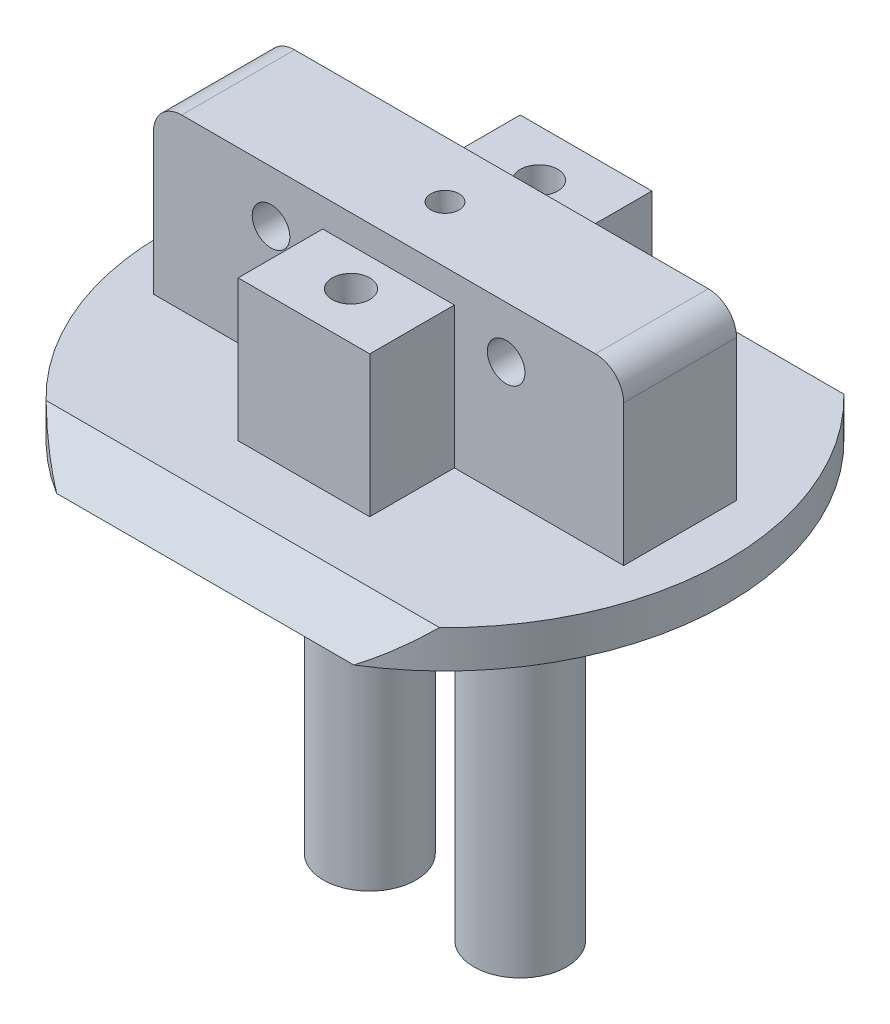
from build123d import *
from build123d.topology import SkipClean

# Parameters (mm, degrees)
SKETCH1_R                            = 30
BOSS_EXTRUDE1_DEPTH                  = 4
BOSS_EXTRUDE2_REACH                  = 44.615
BOSS_EXTRUDE2_END_RADIUS             = 30
BOSS_EXTRUDE2_DIRECTION_2_REACH      = 44.615
BOSS_EXTRUDE2_DIRECTION_2_END_RADIUS = 30
SKETCH3_OUTSIDE_W                    = 78.092
SKETCH3_OUTSIDE_H                    = 69.092
SKETCH3_OUTSIDE_R                    = 21.5
CUT_EXTRUDE2_DEPTH                   = 12.5
BOSS_EXTRUDE3_DEPTH                  = 18
BOSS_EXTRUDE4_DEPTH                  = 15
BOSS_EXTRUDE5_DEPTH                  = 15
CUT_EXTRUDE3_DEPTH                   = 44.292609069
CUT_EXTRUDE3_DEPTH_BACK              = 44.292609069
SKETCH8_R                            = 2
CUT_EXTRUDE8_DEPTH                   = 48.077064479
CUT_EXTRUDE8_DEPTH_BACK              = 48.077064479
CUT_EXTRUDE9_DEPTH                   = 59.659818207
CUT_EXTRUDE11_DEPTH                  = 20
CUT_EXTRUDE12_DEPTH                  = 20
CUT_EXTRUDE13_DEPTH                  = 20
CUT_EXTRUDE14_DEPTH                  = 44.292609069
CUT_EXTRUDE14_DEPTH_BACK             = 44.292609069
SKETCH25_W                           = 66.075437062
SKETCH25_H                           = 20.142243048
SKETCH27_R                           = 1.5
CUT_EXTRUDE16_DEPTH                  = 30
SKETCH28_R                           = 5
CUT_EXTRUDE17_DEPTH                  = 3
CUT_EXTRUDE18_DEPTH                  = 43.690748412
CUT_EXTRUDE18_DEPTH_BACK             = 43.690748412
SKETCH29_W                           = 43.412566799
SKETCH29_H                           = 13.326200919
SKETCH32_W                           = 50
SKETCH32_H                           = 12
BOSS_EXTRUDE6_DEPTH                  = 18
SKETCH35_W                           = 14
SKETCH35_H                           = 15
BOSS_EXTRUDE7_DEPTH                  = 9
CUT_EXTRUDE19_DEPTH                  = 49.746794766
CUT_EXTRUDE19_DEPTH_BACK             = 49.746794766
SKETCH37_R                           = 2
SKETCH36_R                           = 2
CUT_EXTRUDE20_DEPTH                  = 15
SKETCH39_W                           = 14
SKETCH39_H                           = 15
BOSS_EXTRUDE8_DEPTH                  = 9
SKETCH40_R                           = 2
CUT_EXTRUDE21_DEPTH                  = 10
FILLET1_R                            = 3
FILLET2_R                            = 3
CUT_EXTRUDE24_START                  = -20
SKETCH44_R                           = 1.5
CUT_EXTRUDE24_DEPTH                  = 20
SKETCH45_R                           = 4.925
BOSS_EXTRUDE9_DEPTH                  = 42
SKETCH46_R                           = 1.8923
CUT_EXTRUDE25_DEPTH                  = 25.4
SKETCH47_R                           = 1.8923
CUT_EXTRUDE26_DEPTH                  = 25.4


with BuildPart() as part:
    # Sketch1 → Boss-Extrude1 (new body)
    with BuildSketch(Plane(origin=(0, 0, 0), x_dir=(1, 0, 0), z_dir=(0, 1, 0))):
        with Locations(Location((0, 0, 0), (0, 0, 270))):
            Circle(SKETCH1_R)
    extrude(amount=BOSS_EXTRUDE1_DEPTH)

    # Boss-Extrude2: up to this cylinder (the profile starts inside it)
    with SkipClean():  # the faces are left unmerged after this step: merging them gives an invalid solid
        boss_extrude2_end = Plane(origin=(0, 9.396175, 0), z_dir=(0, -1, 0)) * Cylinder(BOSS_EXTRUDE2_END_RADIUS, 150.23, mode=Mode.PRIVATE)
        # Sketch2 → Boss-Extrude2 (add, up to the surface)
        with BuildSketch(Plane(origin=(0, 0, 0), x_dir=(0, 0, -1), z_dir=(1, 0, 0)), mode=Mode.PRIVATE) as boss_extrude2_sk1:
            Polygon((0, 4), (21.5, 4), (9, 16.5), (-9, 16.5), (-21.5, 4), align=None)
        boss_extrude2_tool1 = extrude(boss_extrude2_sk1.sketch, amount=BOSS_EXTRUDE2_REACH, mode=Mode.PRIVATE) & boss_extrude2_end
        add(boss_extrude2_tool1.solids().sort_by_distance((0, 9.396175, 0))[0])

    # Boss-Extrude2 direction 2: up to this cylinder (the profile starts inside it)
    with SkipClean():  # the faces are left unmerged after this step: merging them gives an invalid solid
        boss_extrude2_direction_2_end = Plane(origin=(0, 9.396175, 0), z_dir=(0, -1, 0)) * Cylinder(BOSS_EXTRUDE2_DIRECTION_2_END_RADIUS, 150.23, mode=Mode.PRIVATE)
        # Sketch2 → Boss-Extrude2 direction 2 (add, up to the surface)
        with BuildSketch(Plane(origin=(0, 0, 0), x_dir=(0, 0, -1), z_dir=(1, 0, 0)), mode=Mode.PRIVATE) as boss_extrude2_direction_2_sk1:
            Polygon((0, 4), (21.5, 4), (9, 16.5), (-9, 16.5), (-21.5, 4), align=None)
        boss_extrude2_direction_2_tool1 = extrude(boss_extrude2_direction_2_sk1.sketch, amount=-BOSS_EXTRUDE2_DIRECTION_2_REACH, mode=Mode.PRIVATE) & boss_extrude2_direction_2_end
        add(boss_extrude2_direction_2_tool1.solids().sort_by_distance((0, 9.396175, 0))[0])

    # SurfaceCut1
    split(bisect_by=Plane(origin=(0, 12.75, -12.75), x_dir=(1, 0, 0), z_dir=(0, 0.7071067811865558, -0.7071067811865392)), keep=Keep.BOTTOM)

    # SurfaceCut2
    split(bisect_by=Plane(origin=(0, 12.75, 12.75), x_dir=(1, 0, 0), z_dir=(0, 0.7071067811865509, 0.7071067811865442)), keep=Keep.BOTTOM)

    # Sketch3 outside → Cut-Extrude2 (cut)
    with BuildSketch(Plane(origin=(0, 4, 0), x_dir=(1, 0, 0), z_dir=(0, 1, 0))):
        Rectangle(SKETCH3_OUTSIDE_W, SKETCH3_OUTSIDE_H)
        Circle(SKETCH3_OUTSIDE_R, mode=Mode.SUBTRACT)
    extrude(amount=CUT_EXTRUDE2_DEPTH, mode=Mode.SUBTRACT)

    # Sketch5 → Boss-Extrude3 (add)
    with BuildSketch(Plane(origin=(0, 0, 0), x_dir=(-1, 0, 0), z_dir=(0, -1, 0))):
        Polygon((0, -6), (-17.5, -6), (-17.5, 6), (17.5, 6), (17.5, -6), align=None)
    extrude(amount=BOSS_EXTRUDE3_DEPTH)

    # Sketch6 → Boss-Extrude4 (add)
    with BuildSketch(Plane.XZ):
        Polygon((0, 15), (7, 15), (7, 6), (-7, 6), (-7, 15), align=None)
    extrude(amount=BOSS_EXTRUDE4_DEPTH)

    # Sketch7 → Boss-Extrude5 (add)
    with BuildSketch(Plane.XZ):
        Polygon((0, -15), (7, -15), (7, -6), (-7, -6), (-7, -15), align=None)
    extrude(amount=BOSS_EXTRUDE5_DEPTH)

    # Sketch8 → Cut-Extrude3 (cut, two sides: drawn at the far end of the back side and taken through both)
    with BuildSketch(Plane.XY.offset(-CUT_EXTRUDE3_DEPTH_BACK)):
        with Locations((-12.5, -12.5)):
            Circle(SKETCH8_R)
        with Locations((12.5, -12.5)):
            Circle(SKETCH8_R)
    extrude(amount=CUT_EXTRUDE3_DEPTH + CUT_EXTRUDE3_DEPTH_BACK, mode=Mode.SUBTRACT)

    # Sketch16 → Cut-Extrude8 (cut, two sides: drawn at the far end of the back side and taken through both)
    with BuildSketch(Plane.XY.offset(6).offset(-CUT_EXTRUDE8_DEPTH_BACK)):
        Polygon((17.5, -18), (17.5, -14.5), (14, -18), align=None)
        Polygon((-17.5, -18), (-14, -18), (-17.5, -14.5), align=None)
    extrude(amount=CUT_EXTRUDE8_DEPTH + CUT_EXTRUDE8_DEPTH_BACK, mode=Mode.SUBTRACT)

    # Sketch17 → Cut-Extrude9 (cut, through all)
    with BuildSketch(Plane(origin=(10.365975269, -9.674910251, -8.062425209), x_dir=(-0.3613483622370374, 0.337258471421235, -0.8693009171531012), z_dir=(0.6355070151731325, -0.5931398808282571, -0.49428323402354774))):
        Polygon((-2.372510104, -6.189601271), (7.980636686, -0.706686759), (7.980636686, -10.965829024), align=None)
    extrude(amount=CUT_EXTRUDE9_DEPTH, mode=Mode.SUBTRACT)

    # Sketch19 → Cut-Extrude11 (cut)
    with BuildSketch(Plane(origin=(-10.365975269, -9.674910251, -8.062425209), x_dir=(0.3613483622370374, 0.33725847142123494, -0.8693009171531012), z_dir=(0.6355070151731324, 0.5931398808282571, 0.4942832340235476))):
        Polygon((-2.372510104, -6.189601271), (7.980636686, -10.965829024), (7.980636686, -0.706686759), align=None)
    extrude(amount=-CUT_EXTRUDE11_DEPTH, mode=Mode.SUBTRACT)

    # Sketch20 → Cut-Extrude12 (cut)
    with BuildSketch(Plane(origin=(-10.365975269, -9.674910251, 8.062425209), x_dir=(-0.3613483622370374, -0.3372584714212349, -0.8693009171531013), z_dir=(0.6355070151731326, 0.593139880828257, -0.49428323402354757))):
        Polygon((2.372510104, -6.189601271), (-7.980636686, -0.706686759), (-7.980636686, -10.965829024), align=None)
    extrude(amount=-CUT_EXTRUDE12_DEPTH, mode=Mode.SUBTRACT)

    # Sketch21 → Cut-Extrude13 (cut)
    with BuildSketch(Plane(origin=(10.365975269, -9.674910251, 8.062425209), x_dir=(-0.3613483622370374, 0.3372584714212349, 0.8693009171531013), z_dir=(-0.6355070151731326, 0.593139880828257, -0.49428323402354757))):
        Polygon((-2.372510104, -6.189601271), (7.980636686, -0.706686759), (7.980636686, -10.965829024), align=None)
    extrude(amount=-CUT_EXTRUDE13_DEPTH, mode=Mode.SUBTRACT)

    # Sketch25 → Cut-Extrude14 (cut, two sides: drawn at the far end of the back side and taken through both)
    with BuildSketch(Plane.XY.offset(-CUT_EXTRUDE14_DEPTH_BACK)):
        with Locations((0, -10.071121524)):
            Rectangle(SKETCH25_W, SKETCH25_H)
    extrude(amount=CUT_EXTRUDE14_DEPTH + CUT_EXTRUDE14_DEPTH_BACK, mode=Mode.SUBTRACT)

    # Sketch27 → Cut-Extrude16 (cut)
    with BuildSketch(Plane(origin=(0, 16.5, 0), x_dir=(1, 0, 0), z_dir=(0, 1, 0))):
        with Locations(Location((0, 0, 0), (0, 0, 270))):
            Circle(SKETCH27_R)
    extrude(amount=-CUT_EXTRUDE16_DEPTH, mode=Mode.SUBTRACT)

    # Sketch28 → Cut-Extrude17 (cut)
    with BuildSketch(Plane.XZ):
        with Locations(Location((0, -15, 0), (0, 0, 270))):
            Circle(SKETCH28_R)
        with Locations(Location((22, 0, 0), (0, 0, 270))):
            Circle(SKETCH28_R)
        with Locations(Location((0, 15, 0), (0, 0, 270))):
            Circle(SKETCH28_R)
        with Locations(Location((-22, 0, 0), (0, 0, 270))):
            Circle(SKETCH28_R)
        with Locations(Location((-14, 12, 0), (0, 0, 270))):
            Circle(SKETCH28_R)
        with Locations(Location((14, 12, 0), (0, 0, 270))):
            Circle(SKETCH28_R)
        with Locations(Location((14, -12, 0), (0, 0, 270))):
            Circle(SKETCH28_R)
        with Locations(Location((-14, -12, 0), (0, 0, 270))):
            Circle(SKETCH28_R)
    extrude(amount=-CUT_EXTRUDE17_DEPTH, mode=Mode.SUBTRACT)

    # Sketch29 → Cut-Extrude18 (cut, two sides: drawn at the far end of the back side and taken through both)
    with BuildSketch(Plane(origin=(0, 0, 0), x_dir=(0, 0, -1), z_dir=(1, 0, 0)).offset(-CUT_EXTRUDE18_DEPTH_BACK)):
        with Locations((0.2062834, 10.66310046)):
            Rectangle(SKETCH29_W, SKETCH29_H)
    extrude(amount=CUT_EXTRUDE18_DEPTH + CUT_EXTRUDE18_DEPTH_BACK, mode=Mode.SUBTRACT)

    # Sketch32 → Boss-Extrude6 (add)
    with BuildSketch(Plane(origin=(0, 4, 0), x_dir=(1, 0, 0), z_dir=(0, 1, 0))):
        Rectangle(SKETCH32_W, SKETCH32_H)
    extrude(amount=BOSS_EXTRUDE6_DEPTH)

    # Sketch35 → Boss-Extrude7 (add)
    with BuildSketch(Plane(origin=(0, 0, -6), x_dir=(-1, 0, 0), z_dir=(0, 0, -1))):
        with Locations((0, 11.5)):
            Rectangle(SKETCH35_W, SKETCH35_H)
    extrude(amount=BOSS_EXTRUDE7_DEPTH)

    # Sketch37 → Cut-Extrude19 (cut, two sides: drawn at the far end of the back side and taken through both)
    with BuildSketch(Plane(origin=(0, 0, -6), x_dir=(-1, 0, 0), z_dir=(0, 0, -1)).offset(-CUT_EXTRUDE19_DEPTH_BACK)):
        with Locations((-12.5, 16.5)):
            Circle(SKETCH37_R)
        with Locations((12.5, 16.5)):
            Circle(SKETCH37_R)
    extrude(amount=CUT_EXTRUDE19_DEPTH + CUT_EXTRUDE19_DEPTH_BACK, mode=Mode.SUBTRACT)

    # Sketch36 → Cut-Extrude20 (cut)
    with BuildSketch(Plane(origin=(0, 19, 0), x_dir=(1, 0, 0), z_dir=(0, 1, 0))):
        with Locations(Location((0, 10, 0), (0, 0, 270))):
            Circle(SKETCH36_R)
    extrude(amount=-CUT_EXTRUDE20_DEPTH, mode=Mode.SUBTRACT)

    # Sketch39 → Boss-Extrude8 (add)
    with BuildSketch(Plane.XY.offset(6)):
        with Locations((0, 11.5)):
            Rectangle(SKETCH39_W, SKETCH39_H)
    extrude(amount=BOSS_EXTRUDE8_DEPTH)

    # Sketch40 → Cut-Extrude21 (cut)
    with BuildSketch(Plane(origin=(0, 19, 0), x_dir=(1, 0, 0), z_dir=(0, 1, 0))):
        with Locations(Location((0, -10, 0), (0, 0, 270))):
            Circle(SKETCH40_R)
    extrude(amount=-CUT_EXTRUDE21_DEPTH, mode=Mode.SUBTRACT)

    # Fillet1
    fillet1_edges = [part.edges().sort_by_distance(p)[0] for p in [
        (25, 22, 0),
    ]]
    fillet(fillet1_edges, radius=FILLET1_R)

    # Fillet2
    fillet2_edges = [part.edges().sort_by_distance(p)[0] for p in [
        (-25, 22, 0),
    ]]
    fillet(fillet2_edges, radius=FILLET2_R)

    # Sketch44 → Cut-Extrude24 (cut)
    with BuildSketch(Plane.XZ.offset(-4).offset(CUT_EXTRUDE24_START)):
        with Locations(Location((0, 0, 0), (0, 0, 90))):
            Circle(SKETCH44_R)
    extrude(amount=CUT_EXTRUDE24_DEPTH, mode=Mode.SUBTRACT)

    # Sketch45 → Boss-Extrude9 (add)
    with BuildSketch(Plane.XZ):
        with Locations(Location((-8, 0, 0), (0, 0, 90))):
            Circle(SKETCH45_R)
        with Locations(Location((8, 0, 0), (0, 0, 90))):
            Circle(SKETCH45_R)
    extrude(amount=BOSS_EXTRUDE9_DEPTH)

    # Sketch46 → Cut-Extrude25 (cut)
    with BuildSketch(Plane.XZ.offset(42)):
        with Locations(Location((-8, 0, 0), (0, 0, 270))):
            Circle(SKETCH46_R)
    extrude(amount=-CUT_EXTRUDE25_DEPTH, mode=Mode.SUBTRACT)

    # Sketch47 → Cut-Extrude26 (cut)
    with BuildSketch(Plane.XZ.offset(42)):
        with Locations(Location((8, 0, 0), (0, 0, 270))):
            Circle(SKETCH47_R)
    extrude(amount=-CUT_EXTRUDE26_DEPTH, mode=Mode.SUBTRACT)


solid = part.part
